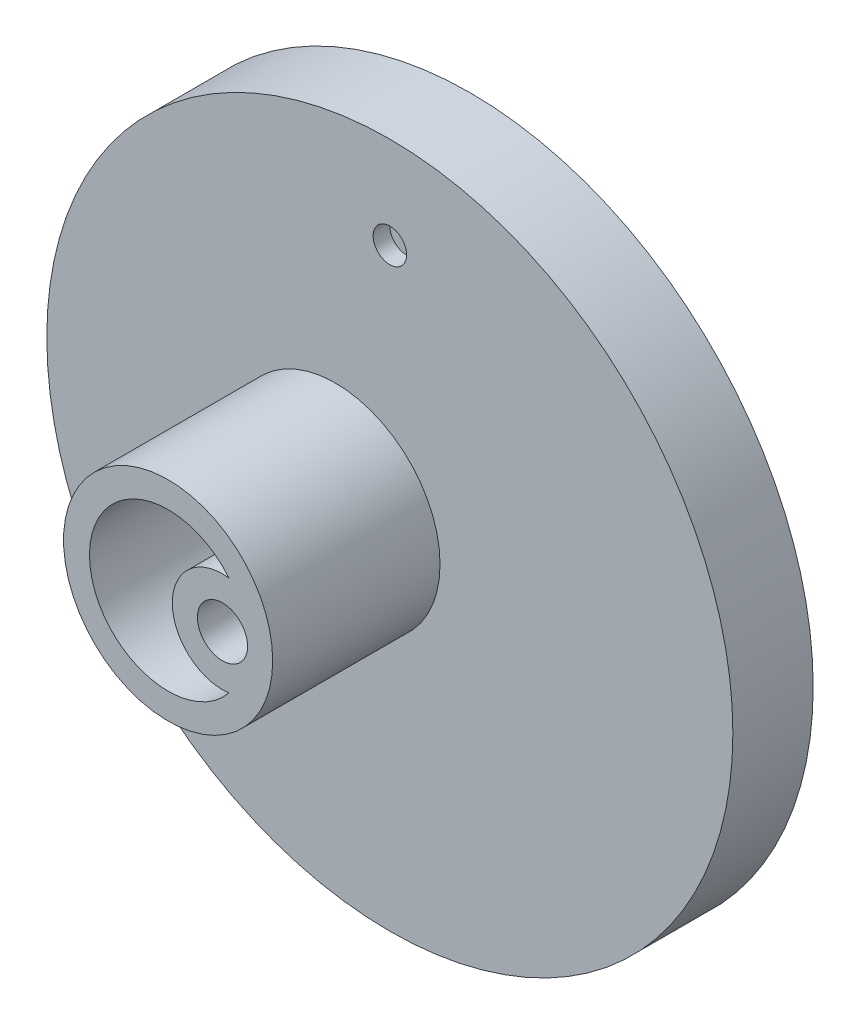
from build123d import *

# Parameters (mm, degrees)
ESQUISSE2_R                  = 20.5
EXTRUSION1_DEPTH             = 4.8
ESQUISSE3_R                  = 6.25
EXTRUSION2_DEPTH             = 10
ENL_V_MAT_EXTRU_1_DEPTH      = 10
ESQUISSE5_R                  = 1.5
ENL_V_MAT_EXTRU_2_DEPTH      = 33.550576032
ESQUISSE6_R                  = 6.4
ENL_V_MAT_EXTRU_3_DEPTH      = 1.8
ESQUISSE7_R                  = 1
ENL_V_MAT_EXTRU_4_DEPTH      = 1
ENL_V_MAT_EXTRU_5_DEPTH      = 1.8
R_P_TITION_CIRCULAIRE1_COUNT = 6


with BuildPart() as part:
    # Esquisse2 → Extrusion1 (new body)
    with BuildSketch(Plane.XY):
        Circle(ESQUISSE2_R)
    extrude(amount=EXTRUSION1_DEPTH)

    # Esquisse3 → Extrusion2 (add)
    with BuildSketch(Plane.XY.offset(4.8)):
        with Locations((-3.25, 0)):
            Circle(ESQUISSE3_R)
    extrude(amount=EXTRUSION2_DEPTH)

    # Esquisse4 → Enlèv. mat.-Extru.1 (cut)
    with BuildSketch(Plane.XY.offset(14.8)):
        with BuildLine():
            ThreePointArc((0.388846154, 2.974693038), (-3, 0), (0.388846154, -2.974693038))
            ThreePointArc((0.388846154, -2.974693038), (-7.95, 0), (0.388846154, 2.974693038))
        make_face()
    extrude(amount=-ENL_V_MAT_EXTRU_1_DEPTH, mode=Mode.SUBTRACT)

    # Esquisse5 → Enlèv. mat.-Extru.2 (cut, through all)
    with BuildSketch(Plane.XY.offset(14.8)):
        Circle(ESQUISSE5_R)
    extrude(amount=-ENL_V_MAT_EXTRU_2_DEPTH, mode=Mode.SUBTRACT)

    # Esquisse6 → Enlèv. mat.-Extru.3 (cut)
    with BuildSketch(Plane(origin=(0, 0, 0), x_dir=(-1, 0, 0), z_dir=(0, 0, -1))):
        Circle(ESQUISSE6_R)
    extrude(amount=-ENL_V_MAT_EXTRU_3_DEPTH, mode=Mode.SUBTRACT)

    # Esquisse7 → Enlèv. mat.-Extru.4 (cut)
    with BuildSketch(Plane.XY.offset(4.8)):
        with Locations((0, 15)):
            Circle(ESQUISSE7_R)
    extrude(amount=-ENL_V_MAT_EXTRU_4_DEPTH, mode=Mode.SUBTRACT)

    # Esquisse8 → Enlèv. mat.-Extru.5 (cut)
    with BuildSketch(Plane(origin=(0, 0, 0), x_dir=(-1, 0, 0), z_dir=(0, 0, -1))):
        with BuildLine():
            Line((-3.190947925, 7.22688393), (-7.708190102, 15.05097689))
            ThreePointArc((-7.708190102, 15.05097689), (0, 16.91), (7.708190102, 15.05097689))
            Line((7.708190102, 15.05097689), (3.190947925, 7.22688393))
            ThreePointArc((3.190947925, 7.22688393), (0, 7.9), (-3.190947925, 7.22688393))
        make_face()
    enl_v_mat_extru_5 = extrude(amount=-ENL_V_MAT_EXTRU_5_DEPTH, mode=Mode.SUBTRACT)

    # Répétition circulaire1: Enlèv. mat.-Extru.5 ×6 about axis
    r_p_tition_circulaire1_axis = Axis((0, 0, 21.473863608), (0, 0, -1))
    for i in range(1, R_P_TITION_CIRCULAIRE1_COUNT):
        add(enl_v_mat_extru_5.rotate(r_p_tition_circulaire1_axis, i * 360 / R_P_TITION_CIRCULAIRE1_COUNT), mode=Mode.SUBTRACT)


solid = part.part
